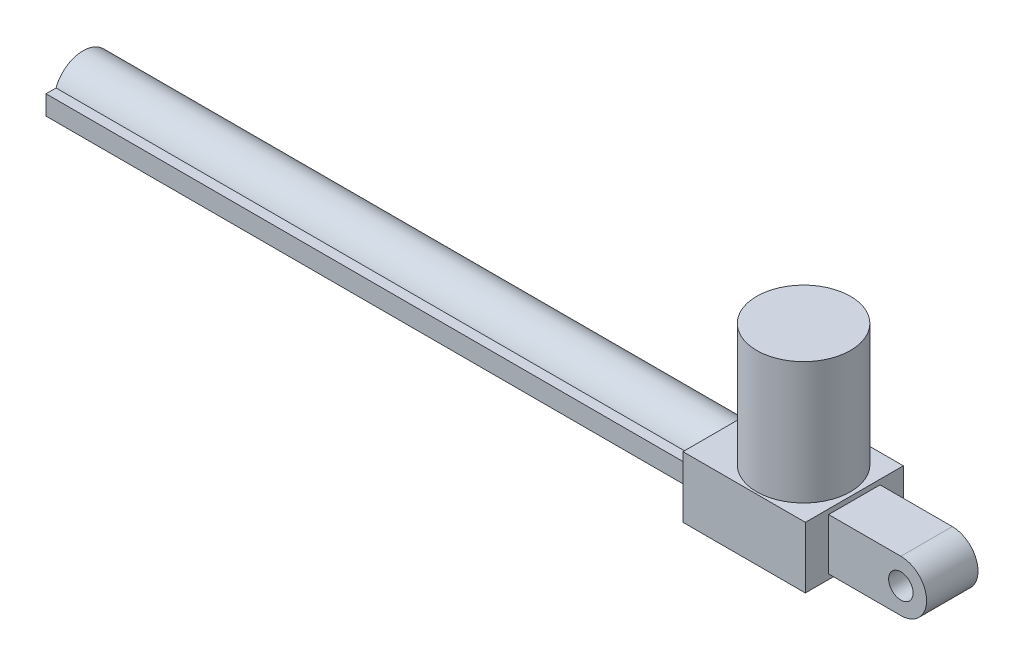
from build123d import *

# Parameters (mm, degrees)
SKETCH1_W               = 50
SKETCH1_H               = 40
BOSS_EXTRUDE1_DEPTH     = 25
BOSS_EXTRUDE2_DEPTH     = 50
BOSS_EXTRUDE3_DEPTH     = 265
SKETCH4_W               = 10.5
SKETCH4_H               = 21
BOSS_EXTRUDE4_DEPTH     = 40
CUT_EXTRUDE3_DEPTH      = 388.585923019
CUT_EXTRUDE3_DEPTH_BACK = 25
SKETCH5_R               = 5


with BuildPart() as part:
    # Sketch1 → Boss-Extrude1 (new body)
    with BuildSketch(Plane(origin=(0, 0, 0), x_dir=(1, 0, 0), z_dir=(0, 1, 0))):
        with Locations((-89.035087719, 3.684210526)):
            Rectangle(SKETCH1_W, SKETCH1_H)
    extrude(amount=BOSS_EXTRUDE1_DEPTH)

    # Sketch2 → Boss-Extrude2 (add)
    with BuildSketch(Plane(origin=(0, 25, 0), x_dir=(1, 0, 0), z_dir=(0, 1, 0))):
        with BuildLine():
            ThreePointArc((-65.611981025, 3.684210526), (-71.223390651, 17.231351748), (-84.770531873, 22.842761374))
            Line((-84.770531873, 22.842761374), (-84.770531873, -15.474340321))
            ThreePointArc((-84.770531873, -15.474340321), (-71.223390651, -9.862930696), (-65.611981025, 3.684210526))
        make_face()
        with BuildLine():
            Line((-84.770531873, -15.474340321), (-84.770531873, 22.842761374))
            ThreePointArc((-84.770531873, 22.842761374), (-103.929082721, 3.684210526), (-84.770531873, -15.474340321))
        make_face()
    extrude(amount=BOSS_EXTRUDE2_DEPTH)

    # Sketch3 → Boss-Extrude3 (add)
    with BuildSketch(Plane.ZY.offset(114.035087719)):
        with BuildLine():
            Line((-3.684210526, 22.014273548), (-3.684210526, 24.28635832))
            ThreePointArc((-3.684210526, 24.28635832), (-15.470568846, 12.5), (-3.684210526, 0.71364168))
            Line((-3.684210526, 0.71364168), (-3.684210526, 2.985726452))
            ThreePointArc((-3.684210526, 2.985726452), (-13.198484074, 12.5), (-3.684210526, 22.014273548))
        make_face()
        with BuildLine():
            ThreePointArc((7.349913455, 16.643229465), (3.027147584, 22.188958394), (-3.684210526, 24.28635832))
            Line((-3.684210526, 24.28635832), (-3.684210526, 22.014273548))
            ThreePointArc((-3.684210526, 22.014273548), (3.043396817, 19.227607344), (5.830063022, 12.5))
            Line((5.830063022, 12.5), (5.830063022, 16.643229465))
            Line((5.830063022, 16.643229465), (7.349913455, 16.643229465))
        make_face()
        with BuildLine():
            ThreePointArc((8.102147793, 12.5), (7.912564487, 14.605481352), (7.349913455, 16.643229465))
            Line((7.349913455, 16.643229465), (5.830063022, 16.643229465))
            Line((5.830063022, 16.643229465), (5.830063022, 12.5))
            Line((5.830063022, 12.5), (5.830063022, 8.73562524))
            Line((5.830063022, 8.73562524), (7.484841587, 8.73562524))
            ThreePointArc((7.484841587, 8.73562524), (7.946797442, 10.592673056), (8.102147793, 12.5))
        make_face()
        with BuildLine():
            Line((-3.684210526, 2.985726452), (-3.684210526, 0.71364168))
            ThreePointArc((-3.684210526, 0.71364168), (3.191470264, 2.926951577), (7.484841587, 8.73562524))
            Line((7.484841587, 8.73562524), (5.830063022, 8.73562524))
            Line((5.830063022, 8.73562524), (5.830063022, 12.5))
            ThreePointArc((5.830063022, 12.5), (3.043396817, 5.772392656), (-3.684210526, 2.985726452))
        make_face()
        with BuildLine():
            Line((11.445254796, 16.643229465), (7.349913455, 16.643229465))
            ThreePointArc((7.349913455, 16.643229465), (7.912564487, 14.605481352), (8.102147793, 12.5))
            ThreePointArc((8.102147793, 12.5), (7.946797442, 10.592673056), (7.484841587, 8.73562524))
            Line((7.484841587, 8.73562524), (11.445254796, 8.73562524))
            Line((11.445254796, 8.73562524), (11.445254796, 16.643229465))
        make_face()
    extrude(amount=BOSS_EXTRUDE3_DEPTH)

    # Sketch4 → Boss-Extrude4 (add)
    with BuildSketch(Plane(origin=(-64.035087719, 0, 0), x_dir=(0, 0, -1), z_dir=(1, 0, 0))):
        with Locations((-1.565789474, 12.5)):
            Rectangle(SKETCH4_W, SKETCH4_H)
        with Locations((8.934210526, 12.5)):
            Rectangle(SKETCH4_W, SKETCH4_H)
    extrude(amount=BOSS_EXTRUDE4_DEPTH)

    # Sketch5 → Cut-Extrude3 (cut, two sides: drawn at the far end of the back side and taken through both)
    with BuildSketch(Plane.XY.offset(6.815789474).offset(-CUT_EXTRUDE3_DEPTH_BACK)):
        with BuildLine():
            Line((-24.035087719, 23), (-34.535087719, 23))
            ThreePointArc((-34.535087719, 23), (-27.110466517, 19.924621202), (-24.035087719, 12.5))
            Line((-24.035087719, 12.5), (-24.035087719, 23))
        make_face()
        with BuildLine():
            Line((-24.035087719, 2), (-24.035087719, 12.5))
            ThreePointArc((-24.035087719, 12.5), (-27.110466517, 5.075378798), (-34.535087719, 2))
            Line((-34.535087719, 2), (-24.035087719, 2))
        make_face()
        with Locations(Location((-34.535087719, 12.5, 0), (0, 0, 90))):
            Circle(SKETCH5_R)
    extrude(amount=CUT_EXTRUDE3_DEPTH + CUT_EXTRUDE3_DEPTH_BACK, mode=Mode.SUBTRACT)


solid = part.part
